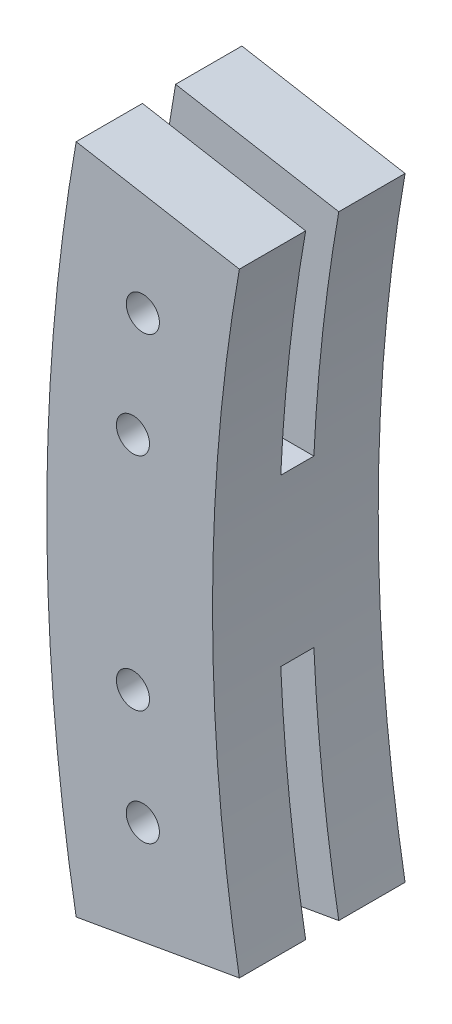
from build123d import *

# Parameters (mm, degrees)
BOSS_EXTRUDE3_DEPTH     = 7.5
CUT_EXTRUDE4_DEPTH      = 1.5
BOSS_EXTRUDE5_DEPTH     = 1.5
SHAFT_HOLE_REACH        = 34.838
SHAFT_HOLE_END_RADIUS   = 175
SKETCH7_R               = 1.5
CUT_EXTRUDE6_DEPTH      = 178.777126726
CUT_EXTRUDE6_DEPTH_BACK = 178.777126726
SKETCH8_R               = 1.5


with BuildPart() as part:
    # Sketch1 → Boss-Extrude3 (new, symmetric)
    with BuildSketch(Plane.XY):
        with BuildLine():
            ThreePointArc((-157.569240482, -27.783708427), (-160, 0), (-157.569240482, 27.783708427))
            Line((-157.569240482, 27.783708427), (-172.341356777, 30.388431092))
            ThreePointArc((-172.341356777, 30.388431092), (-175, 0), (-172.341356777, -30.388431092))
            Line((-172.341356777, -30.388431092), (-157.569240482, -27.783708427))
        make_face()
    extrude(amount=BOSS_EXTRUDE3_DEPTH, both=True)

    # Sketch1<6> → Cut-Extrude4 (cut, symmetric)
    with BuildSketch(Plane.XY):
        with BuildLine():
            Line((-157.569240482, 27.783708427), (-172.341356777, 30.388431092))
            ThreePointArc((-172.341356777, 30.388431092), (-175, 0), (-172.341356777, -30.388431092))
            Line((-172.341356777, -30.388431092), (-157.569240482, -27.783708427))
            ThreePointArc((-157.569240482, -27.783708427), (-160, 0), (-157.569240482, 27.783708427))
        make_face()
    extrude(amount=CUT_EXTRUDE4_DEPTH, both=True, mode=Mode.SUBTRACT)


with BuildPart() as cut_extrude4_piece_1:
    # of the separate pieces the step leaves, piece 1, a body of its own (cut_extrude4_pieces)
    add(part.part.solids().sort_by_distance((-157.569240482, -27.783708427, -1.5))[0])



with BuildPart() as cut_extrude4_piece_2:
    # of the separate pieces the step leaves, piece 2, a body of its own (cut_extrude4_pieces)
    add(part.part.solids().sort_by_distance((-157.569240482, -27.783708427, 7.5))[0])


with BuildPart() as cut_extrude4_piece_1_1:
    add(cut_extrude4_piece_1.part)

    add(cut_extrude4_piece_2.part)  # Boss-Extrude5 merges Cut-Extrude4 piece 2
    # Sketch6 → Boss-Extrude5 (add, symmetric)
    with BuildSketch(Plane.XY):
        with BuildLine():
            Line((-159.824122084, 7.5), (-174.839211849, 7.5))
            ThreePointArc((-174.839211849, 7.5), (-175, 0), (-174.839211849, -7.5))
            Line((-174.839211849, -7.5), (-159.824122084, -7.5))
            ThreePointArc((-159.824122084, -7.5), (-160, 0), (-159.824122084, 7.5))
        make_face()
    extrude(amount=BOSS_EXTRUDE5_DEPTH, both=True)

    # shaft hole: up to this cylinder (the profile starts inside it)
    shaft_hole_end = Plane(origin=(0, 0, 0), z_dir=(0, 0, -1)) * Cylinder(SHAFT_HOLE_END_RADIUS, 420.676, mode=Mode.PRIVATE)
    # Sketch7 → shaft hole (cut, up to the surface)
    with BuildSketch(Plane(origin=(-167.5, 0, 0), x_dir=(0, 0, -1), z_dir=(1, 0, 0)), mode=Mode.PRIVATE) as shaft_hole_sk1:
        Circle(SKETCH7_R)
    shaft_hole_tool1 = extrude(shaft_hole_sk1.sketch, amount=-SHAFT_HOLE_REACH, mode=Mode.PRIVATE) & shaft_hole_end
    add(shaft_hole_tool1.solids().sort_by_distance((-167.5, 0, 0))[0], mode=Mode.SUBTRACT)

    # Sketch8 → Cut-Extrude6 (cut, two sides: drawn at the far end of the back side and taken through both)
    with BuildSketch(Plane.XY.offset(-CUT_EXTRUDE6_DEPTH_BACK)):
        with Locations((-166.306502189, 19.95989303)):
            Circle(SKETCH8_R)
        with Locations((-167.201226072, 10)):
            Circle(SKETCH8_R)
        with Locations((-167.201226072, -10)):
            Circle(SKETCH8_R)
        with Locations((-166.306502189, -19.95989303)):
            Circle(SKETCH8_R)
    extrude(amount=CUT_EXTRUDE6_DEPTH + CUT_EXTRUDE6_DEPTH_BACK, mode=Mode.SUBTRACT)


solid = cut_extrude4_piece_1_1.part
